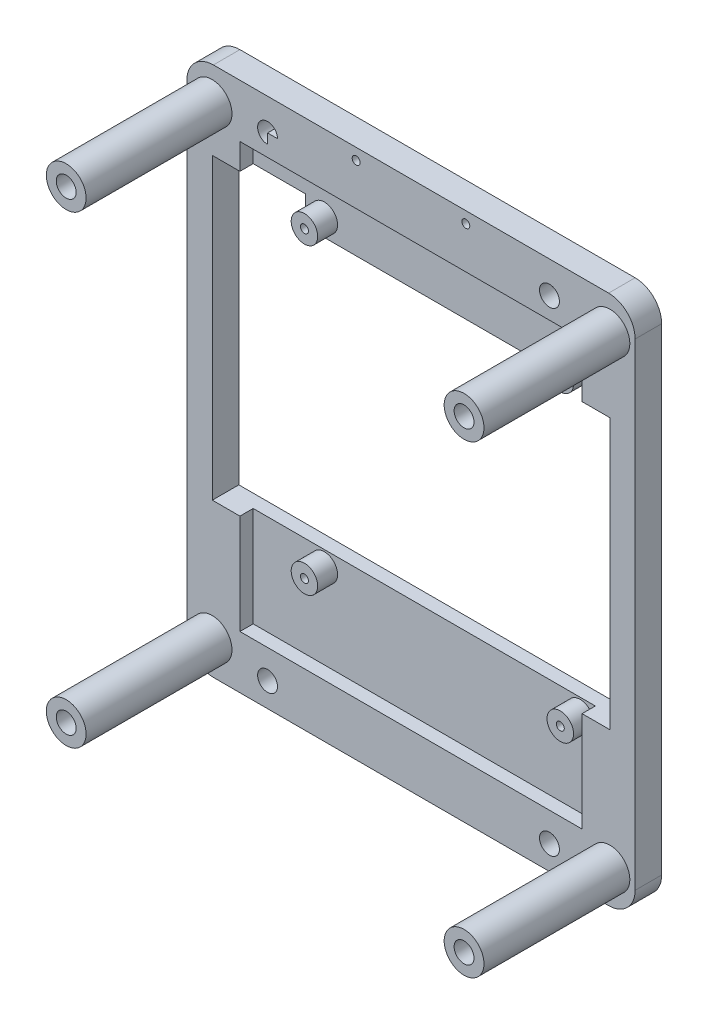
from build123d import *

# Parameters (mm, degrees)
SKETCH1_W           = 85.852
SKETCH1_H           = 101.6
BOSS_EXTRUDE1_DEPTH = 12.7
SHELL1_T            = -10.16
SKETCH3_R           = 2.54
SKETCH3_R_2         = 0.762
BOSS_EXTRUDE7_DEPTH = 3.81
FILLET1_R           = 5.08
CUT_EXTRUDE4_START  = -7.62
CUT_EXTRUDE4_DEPTH  = 7.62
SKETCH10_R          = 3.81
SKETCH10_R_2        = 1.905
BOSS_EXTRUDE6_DEPTH = 27.94
CUT_EXTRUDE5_DEPTH  = 83.058
SKETCH13_R          = 1.905
SKETCH13_R_2        = 0.762
CUT_EXTRUDE6_DEPTH  = 9.906


with BuildPart() as part:
    # Sketch1 → Boss-Extrude1 (new body)
    with BuildSketch(Plane.XY):
        Rectangle(SKETCH1_W, SKETCH1_H)
    extrude(amount=BOSS_EXTRUDE1_DEPTH)

    # Shell1
    shell1_openings = [part.faces().sort_by_distance(p)[0] for p in [
        (0, 0, 12.7),
    ]]
    offset(amount=SHELL1_T, openings=shell1_openings, kind=Kind.INTERSECTION)

    # Sketch3 → Boss-Extrude7 (add)
    # profile 1 of 4: a face of its own
    with BuildSketch(Plane.XY.offset(10.16)):
        with Locations(Location((-19.139245454, 33.606248823, 0), (0, 0, 180))):
            Circle(SKETCH3_R)
        with Locations(Location((-19.139245454, 33.606248823, 0), (0, 0, 180))):
            Circle(SKETCH3_R_2, mode=Mode.SUBTRACT)
    # profile 2 of 4: a face of its own
    with BuildSketch(Plane.XY.offset(10.16)):
        with Locations(Location((29.860754546, 33.606248823, 0), (0, 0, 180))):
            Circle(SKETCH3_R)
        with Locations(Location((29.860754546, 33.606248823, 0), (0, 0, 180))):
            Circle(SKETCH3_R_2, mode=Mode.SUBTRACT)
    # profile 3 of 4: a face of its own
    with BuildSketch(Plane.XY.offset(10.16)):
        with Locations(Location((29.860754546, -24.393751177, 0), (0, 0, 180))):
            Circle(SKETCH3_R)
        with Locations(Location((29.860754546, -24.393751177, 0), (0, 0, 180))):
            Circle(SKETCH3_R_2, mode=Mode.SUBTRACT)
    # profile 4 of 4: a face of its own
    with BuildSketch(Plane.XY.offset(10.16)):
        with Locations(Location((-19.139245454, -24.393751177, 0), (0, 0, 180))):
            Circle(SKETCH3_R)
        with Locations(Location((-19.139245454, -24.393751177, 0), (0, 0, 180))):
            Circle(SKETCH3_R_2, mode=Mode.SUBTRACT)
    extrude(amount=BOSS_EXTRUDE7_DEPTH)

    # Fillet1
    fillet1_edges = [part.edges().sort_by_distance(p)[0] for p in [
        (-42.926, 50.8, 6.35),
        (42.926, 50.8, 6.35),
        (42.926, -50.8, 6.35),
        (-42.926, -50.8, 6.35),
    ]]
    fillet(fillet1_edges, radius=FILLET1_R)

    # Sketch7 → Cut-Extrude4 (cut)
    with BuildSketch(Plane(origin=(0, 0, 0), x_dir=(-1, 0, 0), z_dir=(0, 0, -1)).offset(CUT_EXTRUDE4_START)):
        with BuildLine():
            Line((-37.846, -50.8), (37.846, -50.8))
            ThreePointArc((37.846, -50.8), (41.438102448, -49.312102448), (42.926, -45.72))
            Line((42.926, -45.72), (42.926, 45.72))
            ThreePointArc((42.926, 45.72), (41.438102448, 49.312102448), (37.846, 50.8))
            Line((37.846, 50.8), (-37.846, 50.8))
            ThreePointArc((-37.846, 50.8), (-41.438102448, 49.312102448), (-42.926, 45.72))
            Line((-42.926, 45.72), (-42.926, -45.72))
            ThreePointArc((-42.926, -45.72), (-41.438102448, -49.312102448), (-37.846, -50.8))
        make_face()
    extrude(amount=CUT_EXTRUDE4_DEPTH, mode=Mode.SUBTRACT)

    # Sketch10 → Boss-Extrude6 (add)
    # profile 1 of 4: a face of its own
    with BuildSketch(Plane.XY.offset(12.7)):
        with Locations((-38.1, 44.45)):
            Circle(SKETCH10_R)
        with Locations((-38.1, 44.45)):
            Circle(SKETCH10_R_2, mode=Mode.SUBTRACT)
    # profile 2 of 4: a face of its own
    with BuildSketch(Plane.XY.offset(12.7)):
        with Locations((38.1, 44.45)):
            Circle(SKETCH10_R)
        with Locations((38.1, 44.45)):
            Circle(SKETCH10_R_2, mode=Mode.SUBTRACT)
    # profile 3 of 4: a face of its own
    with BuildSketch(Plane.XY.offset(12.7)):
        with Locations((38.1, -44.45)):
            Circle(SKETCH10_R)
        with Locations((38.1, -44.45)):
            Circle(SKETCH10_R_2, mode=Mode.SUBTRACT)
    # profile 4 of 4: a face of its own
    with BuildSketch(Plane.XY.offset(12.7)):
        with Locations((-38.1, -44.45)):
            Circle(SKETCH10_R)
        with Locations((-38.1, -44.45)):
            Circle(SKETCH10_R_2, mode=Mode.SUBTRACT)
    extrude(amount=BOSS_EXTRUDE6_DEPTH)

    # Sketch11 → Cut-Extrude5 (cut)
    with BuildSketch(Plane.XY):
        Polygon((-38.054358592, -21.497558928), (38.145641408, -21.497558928), (38.145641408, 30.251057274), (-22.70646811, 30.251057274), (-22.70646811, 35.689101497), (-38.054358592, 35.689101497), align=None)
    extrude(amount=CUT_EXTRUDE5_DEPTH, mode=Mode.SUBTRACT)

    # Sketch13 → Cut-Extrude6 (cut)
    with BuildSketch(Plane.XY.offset(12.7)):
        with BuildLine():
            Line((-27.477284385, 42.802269742), (-27.477284385, 44.707269742))
            Line((-27.477284385, 44.707269742), (-25.572284385, 44.707269742))
            ThreePointArc((-25.572284385, 44.707269742), (-28.824322804, 46.05430816), (-27.477284385, 42.802269742))
        make_face()
        with Locations((26.520719639, 44.707269742)):
            Circle(SKETCH13_R)
        with Locations((-27.477284385, -46.187542617)):
            Circle(SKETCH13_R)
        with Locations((26.520719639, -46.187542617)):
            Circle(SKETCH13_R)
        with Locations((10.5, 48.630171944)):
            Circle(SKETCH13_R_2)
        with Locations((-10.5, 48.630171944)):
            Circle(SKETCH13_R_2)
    extrude(amount=-CUT_EXTRUDE6_DEPTH, mode=Mode.SUBTRACT)


solid = part.part
